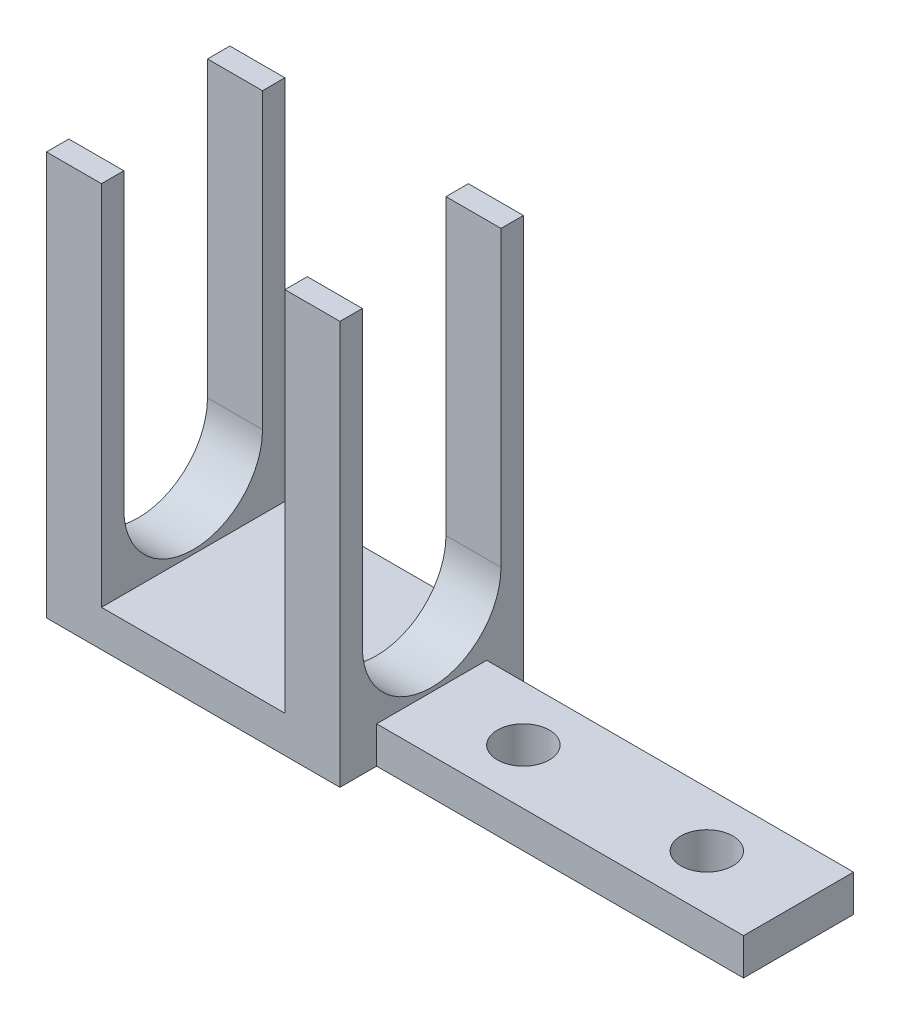
from build123d import *

# Parameters (mm, degrees)
SKETCH1_W             = 31.75
SKETCH1_H             = 9.525
BOSS_EXTRUDE1_DEPTH   = 3.175
F_8_CLEARANCE_HOLE1_D = 4.4958
SKETCH4_W             = 25.4
SKETCH4_H             = 15.875
BOSS_EXTRUDE2_DEPTH   = 3.175
SKETCH5_W             = 4.7625
SKETCH5_H             = 15.875
BOSS_EXTRUDE3_DEPTH   = 31.75
CUT_EXTRUDE1_DEPTH    = 68.445400371
LPATTERN1_COUNT       = 2
LPATTERN1_PITCH       = 20.6375


with BuildPart() as part:
    # Sketch1 → Boss-Extrude1 (new body)
    with BuildSketch(Plane(origin=(0, 0, 0), x_dir=(1, 0, 0), z_dir=(0, 1, 0))):
        Rectangle(SKETCH1_W, SKETCH1_H)
    extrude(amount=BOSS_EXTRUDE1_DEPTH)

    # #8 Clearance Hole1 (through all)
    with Locations(Plane(origin=(0, 3.175, 0), x_dir=(1, 0, 0), z_dir=(0, 1, 0))):
        with Locations((-7.9375, 0), (7.9375, 0)):
            Hole(F_8_CLEARANCE_HOLE1_D / 2)

    # Sketch4 → Boss-Extrude2 (add)
    with BuildSketch(Plane(origin=(0, 0, 0), x_dir=(1, 0, 0), z_dir=(0, 1, 0))):
        with Locations((-28.575, 0)):
            Rectangle(SKETCH4_W, SKETCH4_H)
    extrude(amount=BOSS_EXTRUDE2_DEPTH)

    # Sketch5 → Boss-Extrude3 (add)
    with BuildSketch(Plane(origin=(0, 3.175, 0), x_dir=(1, 0, 0), z_dir=(0, 1, 0))):
        with Locations((-38.89375, 0)):
            Rectangle(SKETCH5_W, SKETCH5_H)
    boss_extrude3 = extrude(amount=BOSS_EXTRUDE3_DEPTH)

    # Sketch7 → Cut-Extrude1 (cut, through all)
    with BuildSketch(Plane.ZY.offset(41.275)):
        with BuildLine():
            Line((6, 34.925), (6, 9.525))
            ThreePointArc((6, 9.525), (0, 3.525), (-6, 9.525))
            Line((-6, 9.525), (-6, 34.925))
            ThreePointArc((-6, 34.925), (0, 40.925), (6, 34.925))
        make_face()
    cut_extrude1 = extrude(amount=-CUT_EXTRUDE1_DEPTH, mode=Mode.SUBTRACT)

    # LPattern1: Boss-Extrude3, Cut-Extrude1 ×2
    with Locations(*[(i * LPATTERN1_PITCH, 0, 0) for i in range(1, LPATTERN1_COUNT)]):
        add(boss_extrude3)
        add(cut_extrude1, mode=Mode.SUBTRACT)


solid = part.part
